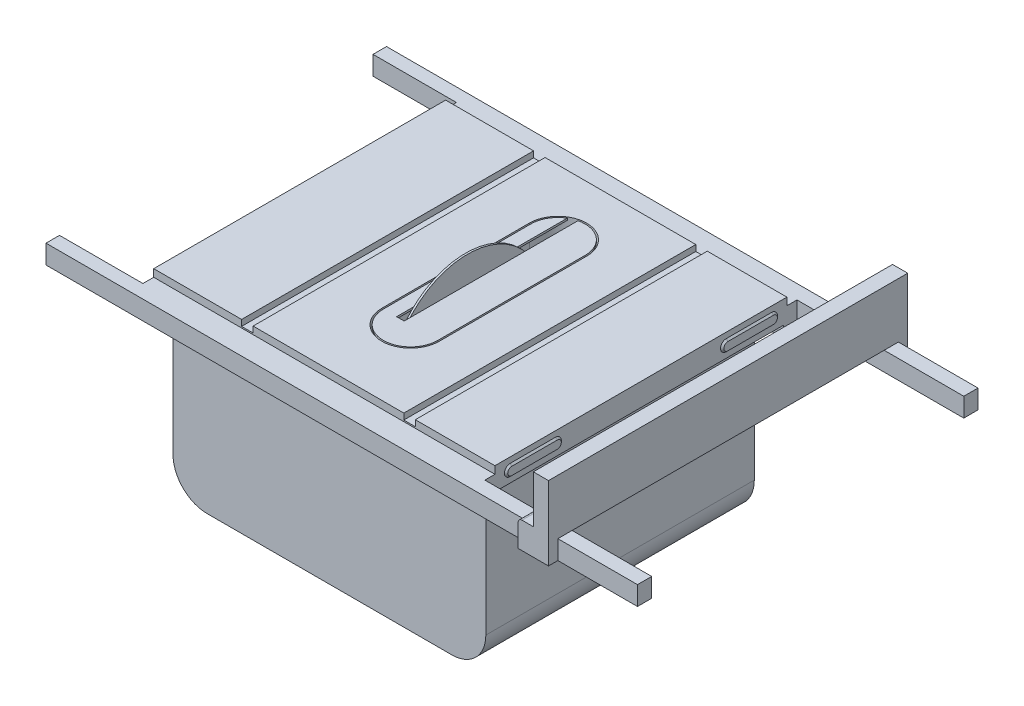
from build123d import *

# Parameters (mm, degrees)
SKETCH1_W                = 571.5
SKETCH1_H                = 488.95
EXTRUDE1_DEPTH           = 37.9015625
SKETCH2_W                = 571.5
SKETCH2_H                = 40.6796875
SKETCH2_H_2              = 18.0578125
EXTRUDE5_DEPTH           = 25.4
SKETCH6_W                = 23.8125
SKETCH6_H                = 31.75
EXTRUDE6_DEPTH           = 571.5
SKETCH7_W                = 3.175
SKETCH7_H                = 12.7
EXTRUDE7_DEPTH           = 571.5
EXTRUDE8_DEPTH           = 2.778125
EXTRUDE8_DRAFT           = 45
EXTRUDE8_PROFILE_2_DEPTH = 2.778125
EXTRUDE8_PROFILE_2_DRAFT = 45
MIRROR2_COPY_1_DEPTH     = 2.778125
MIRROR2_COPY_1_DRAFT     = 45
MIRROR2_COPY_2_DEPTH     = 2.778125
MIRROR2_COPY_2_DRAFT     = 45
MIRROR2_COPY_3_DEPTH     = 2.778125
MIRROR2_COPY_3_DRAFT     = 45
EXTRUDE9_DEPTH           = 490.247968132
SKETCH10_W               = 19.2484375
SKETCH10_H               = 488.95
EXTRUDE10_DEPTH          = 10.1203125
SKETCH3_W                = 23.8125
SKETCH3_H                = 31.75
EXTRUDE3_DEPTH           = 565.15
EXTRUDE4_REACH           = 806.917
SKETCH11_W               = 25.4
SKETCH11_H               = 123.825
EXTRUDE11_DEPTH          = 15.6765625
SKETCH12_W               = 25.4
SKETCH12_H               = 44.2515625
EXTRUDE12_DEPTH          = 15.6765625
SKETCH13_W               = 25.4
SKETCH13_H               = 44.2515625
EXTRUDE13_DEPTH          = 15.6765625
FILLET1_R                = 6.35
EXTRUDE14_DEPTH          = 224.8296875
SKETCH15_R               = 127
EXTRUDE15_DEPTH          = 1.5875
EXTRUDE16_DEPTH          = 3.175
SKETCH17_R               = 31.75
SKETCH17_R_2             = 29.21
EXTRUDE17_DEPTH          = 12.7
EXTRUDE18_START          = -76.2
SKETCH18_W               = 203.2
SKETCH18_H               = 146.05
SKETCH18_R               = 31.75
SKETCH18_R_2             = 29.21
EXTRUDE18_DEPTH          = 76.2
EXTRUDE20_START          = -285.75
SKETCH20_W               = 22.621875
SKETCH20_H               = 31.75
EXTRUDE20_DEPTH          = 425.45


with BuildPart() as part:
    # Sketch1 → Extrude1 (new body)
    with BuildSketch(Plane(origin=(0, 0, 0), x_dir=(1, 0, 0), z_dir=(0, 1, 0))):
        Rectangle(SKETCH1_W, SKETCH1_H)
    extrude(amount=-EXTRUDE1_DEPTH)

    # Sketch2 → Extrude5 (add)
    with BuildSketch(Plane(origin=(0, -37.9015625, 0), x_dir=(1, 0, 0), z_dir=(0, 1, 0))):
        with Locations((0, -264.81484375)):
            Rectangle(SKETCH2_W, SKETCH2_H)
        with Locations((0, 253.50390625)):
            Rectangle(SKETCH2_W, SKETCH2_H_2)
    extrude(amount=EXTRUDE5_DEPTH)

    # Sketch6 → Extrude6 (add)
    with BuildSketch(Plane.ZY.offset(285.75)):
        with Locations((273.2484375, -28.3765625)):
            Rectangle(SKETCH6_W, SKETCH6_H)
        with Locations((-250.6265625, -28.3765625)):
            Rectangle(SKETCH6_W, SKETCH6_H)
    extrude(amount=-EXTRUDE6_DEPTH)

    # Sketch7 → Extrude7 (add)
    with BuildSketch(Plane.ZY.offset(285.75)):
        with Locations((262.9296875, -50.6015625)):
            Rectangle(SKETCH7_W, SKETCH7_H)
        with Locations((-240.3078125, -50.6015625)):
            Rectangle(SKETCH7_W, SKETCH7_H)
    extrude(amount=-EXTRUDE7_DEPTH)


with BuildPart() as extrude8_tool:
    # Sketch8 → Extrude8 (with draft: the straight prism first)
    with BuildSketch(Plane.ZY.offset(285.75)):
        with BuildLine():
            Line((-219.075, -28.47578125), (-142.875, -28.47578125))
            ThreePointArc((-142.875, -28.47578125), (-133.35, -18.95078125), (-142.875, -9.42578125))
            Line((-142.875, -9.42578125), (-219.075, -9.42578125))
            ThreePointArc((-219.075, -9.42578125), (-228.6, -18.95078125), (-219.075, -28.47578125))
        make_face()
    extrude(amount=EXTRUDE8_DEPTH)
    # Extrude8: the draft: its side faces are tilted about the plane it starts from
    extrude8_sides = [extrude8_tool.faces().sort_by_distance(p)[0] for p in [
        (-287.1390625, -18.95078125, -228.6),
        (-287.1390625, -28.47578125, -180.975),
        (-287.1390625, -18.95078125, -133.35),
        (-287.1390625, -9.42578125, -180.975),
    ]]
    draft(extrude8_sides, Plane.ZY.offset(285.75), EXTRUDE8_DRAFT)


with BuildPart() as part_1:
    add(part.part)

    # Extrude8: add extrude8_tool
    add(extrude8_tool.part)


with BuildPart() as extrude8_profile_2_tool:
    # Sketch8 → Extrude8 profile 2 (with draft: the straight prism first)
    with BuildSketch(Plane.ZY.offset(285.75)):
        with BuildLine():
            Line((142.875, -28.47578125), (219.075, -28.47578125))
            ThreePointArc((219.075, -28.47578125), (228.6, -18.95078125), (219.075, -9.42578125))
            Line((219.075, -9.42578125), (142.875, -9.42578125))
            ThreePointArc((142.875, -9.42578125), (133.35, -18.95078125), (142.875, -28.47578125))
        make_face()
    extrude(amount=EXTRUDE8_PROFILE_2_DEPTH)
    # Extrude8 profile 2: the draft: its side faces are tilted about the plane it starts from
    extrude8_profile_2_sides = [extrude8_profile_2_tool.faces().sort_by_distance(p)[0] for p in [
        (-287.1390625, -18.95078125, 133.35),
        (-287.1390625, -28.47578125, 180.975),
        (-287.1390625, -18.95078125, 228.6),
        (-287.1390625, -9.42578125, 180.975),
    ]]
    draft(extrude8_profile_2_sides, Plane.ZY.offset(285.75), EXTRUDE8_PROFILE_2_DRAFT)


with BuildPart() as part_2:
    add(part_1.part)

    # Extrude8 profile 2: add extrude8_profile_2_tool
    add(extrude8_profile_2_tool.part)


with BuildPart() as mirror2_copy_1_tool:
    # Mirror2 copy 1 sketch → Mirror2 copy 1 (with draft: the straight prism first)
    with BuildSketch(Plane(origin=(285.75, 0, 0), x_dir=(0, 0, 1), z_dir=(1, 0, 0))):
        with BuildLine():
            Line((-219.075, 28.47578125), (-142.875, 28.47578125))
            ThreePointArc((-142.875, 28.47578125), (-133.35, 18.95078125), (-142.875, 9.42578125))
            Line((-142.875, 9.42578125), (-219.075, 9.42578125))
            ThreePointArc((-219.075, 9.42578125), (-228.6, 18.95078125), (-219.075, 28.47578125))
        make_face()
    extrude(amount=MIRROR2_COPY_1_DEPTH)
    # Mirror2 copy 1: the draft: its side faces are tilted about the plane it starts from
    mirror2_copy_1_sides = [mirror2_copy_1_tool.faces().sort_by_distance(p)[0] for p in [
        (287.1390625, -18.95078125, -228.6),
        (287.1390625, -28.47578125, -180.975),
        (287.1390625, -18.95078125, -133.35),
        (287.1390625, -9.42578125, -180.975),
    ]]
    draft(mirror2_copy_1_sides, Plane(origin=(285.75, 0, 0), x_dir=(0, 0, 1), z_dir=(1, 0, 0)), MIRROR2_COPY_1_DRAFT)


with BuildPart() as part_3:
    add(part_2.part)

    # Mirror2 copy 1: add mirror2_copy_1_tool
    add(mirror2_copy_1_tool.part)


with BuildPart() as mirror2_copy_2_tool:
    # Mirror2 copy 2 sketch → Mirror2 copy 2 (with draft: the straight prism first)
    with BuildSketch(Plane(origin=(285.75, 0, 0), x_dir=(0, 0, 1), z_dir=(1, 0, 0))):
        with BuildLine():
            Line((142.875, 28.47578125), (219.075, 28.47578125))
            ThreePointArc((219.075, 28.47578125), (228.6, 18.95078125), (219.075, 9.42578125))
            Line((219.075, 9.42578125), (142.875, 9.42578125))
            ThreePointArc((142.875, 9.42578125), (133.35, 18.95078125), (142.875, 28.47578125))
        make_face()
    extrude(amount=MIRROR2_COPY_2_DEPTH)
    # Mirror2 copy 2: the draft: its side faces are tilted about the plane it starts from
    mirror2_copy_2_sides = [mirror2_copy_2_tool.faces().sort_by_distance(p)[0] for p in [
        (287.1390625, -18.95078125, 133.35),
        (287.1390625, -28.47578125, 180.975),
        (287.1390625, -18.95078125, 228.6),
        (287.1390625, -9.42578125, 180.975),
    ]]
    draft(mirror2_copy_2_sides, Plane(origin=(285.75, 0, 0), x_dir=(0, 0, 1), z_dir=(1, 0, 0)), MIRROR2_COPY_2_DRAFT)


with BuildPart() as part_4:
    add(part_3.part)

    # Mirror2 copy 2: add mirror2_copy_2_tool
    add(mirror2_copy_2_tool.part)


with BuildPart() as mirror2_copy_3_tool:
    # Mirror2 copy 3 sketch → Mirror2 copy 3 (with draft: the straight prism first)
    with BuildSketch(Plane(origin=(285.75, 0, 0), x_dir=(0, 0, 1), z_dir=(1, 0, 0))):
        with BuildLine():
            Line((142.875, 28.47578125), (219.075, 28.47578125))
            ThreePointArc((219.075, 28.47578125), (228.6, 18.95078125), (219.075, 9.42578125))
            Line((219.075, 9.42578125), (142.875, 9.42578125))
            ThreePointArc((142.875, 9.42578125), (133.35, 18.95078125), (142.875, 28.47578125))
        make_face()
    extrude(amount=MIRROR2_COPY_3_DEPTH)
    # Mirror2 copy 3: the draft: its side faces are tilted about the plane it starts from
    mirror2_copy_3_sides = [mirror2_copy_3_tool.faces().sort_by_distance(p)[0] for p in [
        (287.1390625, -18.95078125, 133.35),
        (287.1390625, -28.47578125, 180.975),
        (287.1390625, -18.95078125, 228.6),
        (287.1390625, -9.42578125, 180.975),
    ]]
    draft(mirror2_copy_3_sides, Plane(origin=(285.75, 0, 0), x_dir=(0, 0, 1), z_dir=(1, 0, 0)), MIRROR2_COPY_3_DRAFT)


with BuildPart() as part_5:
    add(part_4.part)

    # Mirror2 copy 3: add mirror2_copy_3_tool
    add(mirror2_copy_3_tool.part)

    # Sketch9 → Extrude9 (cut, through all)
    with BuildSketch(Plane(origin=(56.753125, 0, -56.753125), x_dir=(0, 0, -1), z_dir=(0, 1, 0))):
        with BuildLine():
            Line((-167.48125, 94.059375), (79.375, 94.059375))
            ThreePointArc((79.375, 94.059375), (127.396875, 46.0375), (79.375, -1.984375))
            Line((79.375, -1.984375), (-167.48125, -1.984375))
            ThreePointArc((-167.48125, -1.984375), (-215.503125, 46.0375), (-167.48125, 94.059375))
        make_face()
    extrude(amount=-EXTRUDE9_DEPTH, mode=Mode.SUBTRACT)

    # Sketch10 → Extrude10 (cut)
    with BuildSketch(Plane(origin=(0, 0, 0), x_dir=(1, 0, 0), z_dir=(0, 1, 0))):
        with Locations((-128.88515625, 0)):
            Rectangle(SKETCH10_W, SKETCH10_H)
        with Locations((142.77578125, 0)):
            Rectangle(SKETCH10_W, SKETCH10_H)
    extrude(amount=-EXTRUDE10_DEPTH, mode=Mode.SUBTRACT)

    # Sketch3 → Extrude3 (add)
    with BuildSketch(Plane(origin=(0, 0, 0), x_dir=(0, 0, -1), z_dir=(1, 0, 0))):
        with Locations((-273.2484375, -28.3765625)):
            Rectangle(SKETCH3_W, SKETCH3_H)
    extrude3 = extrude(amount=EXTRUDE3_DEPTH)

    # Mirror1: Extrude3 across plane
    add(extrude3.mirror(Plane.XY))

    # Extrude4: up to this face of the body (flat: up to its plane)
    extrude4_end = Plane(part_5.part.faces().sort_by_distance((282.575, -28.3765625, -285.1546875))[0])
    # Sketch4 → Extrude4 (add, up to the picked face)
    with BuildSketch(Plane.XY.offset(285.1546875), mode=Mode.PRIVATE) as extrude4_sk1:
        Polygon((381, 0), (406.4, 0), (406.4, 79.5734375), (431.8, 79.5734375), (431.8, -12.5015625), (381, -12.5015625), align=None)
    extrude4_tool1 = split(extrude(extrude4_sk1.sketch, amount=-EXTRUDE4_REACH, mode=Mode.PRIVATE), bisect_by=extrude4_end, keep=Keep.BOTH, mode=Mode.PRIVATE)
    add(extrude4_tool1.solids().sort_by(Axis((416.063567, 28.77965, 285.154688), (0, 0, -1)))[0])

    # Sketch11 → Extrude11 (add)
    with BuildSketch(Plane.XY.offset(285.1546875)):
        with Locations((419.1, 17.6609375)):
            Rectangle(SKETCH11_W, SKETCH11_H)
    extrude11 = extrude(amount=EXTRUDE11_DEPTH)

    # Mirror3: Extrude11 across plane
    add(extrude11.mirror(Plane.XY))

    # Sketch12 → Extrude12 (add)
    with BuildSketch(Plane.XY.offset(285.1546875)):
        with Locations((393.7, -22.12578125)):
            Rectangle(SKETCH12_W, SKETCH12_H)
    extrude(amount=EXTRUDE12_DEPTH)

    # Sketch13 → Extrude13 (add)
    with BuildSketch(Plane(origin=(0, 0, -300.83125), x_dir=(-1, 0, 0), z_dir=(0, 0, -1))):
        with Locations((-393.7, -22.12578125)):
            Rectangle(SKETCH13_W, SKETCH13_H)
    extrude(amount=-EXTRUDE13_DEPTH)

    # Fillet1
    fillet1_edges = [part_5.edges().sort_by_distance(p)[0] for p in [
        (381, 0, 0),
    ]]
    fillet(fillet1_edges, radius=FILLET1_R)

    # Sketch14 → Extrude14 (add)
    with BuildSketch(Plane.XY.offset(224.8296875)):
        with BuildLine():
            Line((-273.05, -37.9015625), (250.825, -37.9015625))
            Line((250.825, -37.9015625), (250.825, -273.05))
            ThreePointArc((250.825, -273.05), (234.086152545, -313.461152545), (193.675, -330.2))
            Line((193.675, -330.2), (-215.9, -330.2))
            ThreePointArc((-215.9, -330.2), (-256.311152545, -313.461152545), (-273.05, -273.05))
            Line((-273.05, -273.05), (-273.05, -37.9015625))
        make_face()
    extrude14 = extrude(amount=-EXTRUDE14_DEPTH)

    # Mirror6: Extrude14 across plane
    add(extrude14.mirror(Plane.XY))

    # Sketch15 → Extrude15 (add, symmetric)
    with BuildSketch(Plane(origin=(-6.35, 0, 0), x_dir=(0, 0, -1), z_dir=(1, 0, 0))):
        with Locations((0, -87.820142217)):
            Circle(SKETCH15_R)
    extrude(amount=EXTRUDE15_DEPTH, both=True)

    # Sketch17 → Extrude17 (add)
    with BuildSketch(Plane(origin=(0, 0, -224.8296875), x_dir=(-1, 0, 0), z_dir=(0, 0, -1))):
        with Locations((6.35, -254)):
            Circle(SKETCH17_R)
        with Locations((6.35, -254)):
            Circle(SKETCH17_R_2, mode=Mode.SUBTRACT)
    extrude(amount=EXTRUDE17_DEPTH)

    # Sketch18 → Extrude18 (cut)
    # profile 1 of 2: a face of its own
    with BuildSketch(Plane(origin=(0, 0, -224.8296875), x_dir=(-1, 0, 0), z_dir=(0, 0, -1)).offset(EXTRUDE18_START)):
        with Locations((6.35, -225.425)):
            Rectangle(SKETCH18_W, SKETCH18_H)
        with Locations((6.35, -254)):
            Circle(SKETCH18_R, mode=Mode.SUBTRACT)
    # profile 2 of 2: a face of its own
    with BuildSketch(Plane(origin=(0, 0, -224.8296875), x_dir=(-1, 0, 0), z_dir=(0, 0, -1)).offset(EXTRUDE18_START)):
        with Locations((6.35, -254)):
            Circle(SKETCH18_R_2)
    extrude(amount=EXTRUDE18_DEPTH, mode=Mode.SUBTRACT)

    # Sketch20 → Extrude20 (add)
    with BuildSketch(Plane.ZY.offset(285.75).offset(EXTRUDE20_START)):
        with Locations((-273.84375, -28.3765625)):
            Rectangle(SKETCH20_W, SKETCH20_H)
        with Locations((273.84375, -28.3765625)):
            Rectangle(SKETCH20_W, SKETCH20_H)
    extrude(amount=EXTRUDE20_DEPTH)


with BuildPart() as body_2:
    # Sketch16 → Extrude16 (new body)
    with BuildSketch(Plane(origin=(0, 0, 0), x_dir=(1, 0, 0), z_dir=(0, 1, 0))):
        with BuildLine():
            Line((-34.76625, 136.128125), (-34.76625, -110.728125))
            ThreePointArc((-34.76625, -110.728125), (10.715625, -156.21), (56.1975, -110.728125))
            Line((56.1975, -110.728125), (56.1975, 136.128125))
            ThreePointArc((56.1975, 136.128125), (38.833539545, 171.877024775), (0, 180.329667217))
            Line((0, 180.329667217), (0, -110.728125))
            Line((0, -110.728125), (-12.7, -110.728125))
            Line((-12.7, -110.728125), (-12.7, 175.11927091))
            ThreePointArc((-12.7, 175.11927091), (-28.867120501, 158.529178817), (-34.76625, 136.128125))
        make_face()
    extrude(amount=-EXTRUDE16_DEPTH)


solid = Compound([part_5.part, body_2.part])
